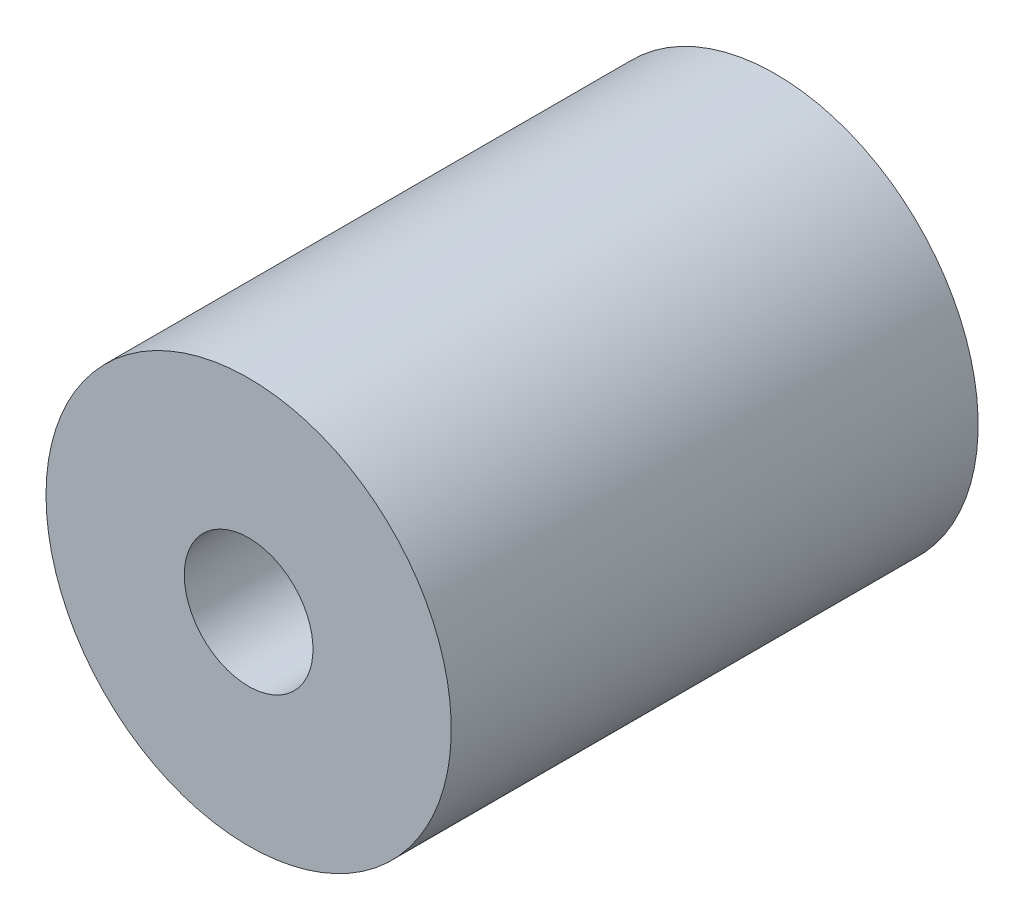
from build123d import *

# Parameters (mm, degrees)
SKETCH_1_R          = 10
SKETCH_1_R_2        = 3.175
EXTRUDE_1_DEPTH     = 26
SKETCH_3_R          = 4
CUT_EXTRUDE_1_DEPTH = 6.5


with BuildPart() as part:
    # 草图1 → 凸台-拉伸1 (new body)
    with BuildSketch(Plane.XY):
        with Locations(Location((0, 0, 0), (0, 0, 180))):
            Circle(SKETCH_1_R)
        with Locations(Location((0, 0, 0), (0, 0, 180))):
            Circle(SKETCH_1_R_2, mode=Mode.SUBTRACT)
    extrude(amount=EXTRUDE_1_DEPTH)

    # 草图3 → 切除-拉伸1 (cut)
    with BuildSketch(Plane(origin=(0, 0, 0), x_dir=(-1, 0, 0), z_dir=(0, 0, -1))):
        Circle(SKETCH_3_R)
    extrude(amount=-CUT_EXTRUDE_1_DEPTH, mode=Mode.SUBTRACT)


solid = part.part
